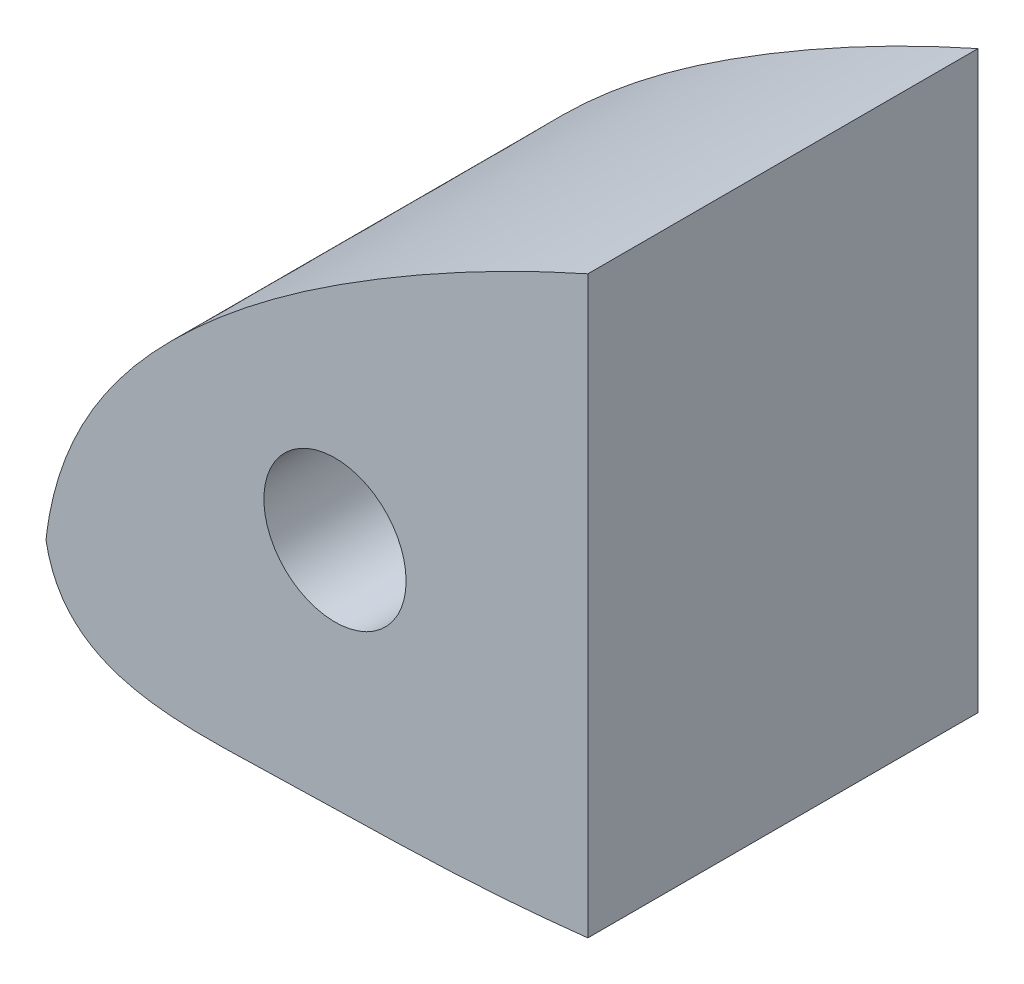
from build123d import *

# Parameters (mm, degrees)
BOSS_EXTRUDE1_DEPTH = 27.432
SKETCH2_R           = 5
SKETCH2_R_2         = 3.175
CUT_EXTRUDE1_DEPTH  = 317.917465392
SKETCH3_W           = 293.188888759
SKETCH3_H           = 137.971241769
CUT_EXTRUDE2_DEPTH  = 317.917465392


with BuildPart() as part:
    # Sketch1 → Boss-Extrude1 (new body)
    with BuildSketch(Plane.XY):
        with BuildLine():
            add(Edge.make_bspline(
                [(0.000560351, 0.000130087), (0.810633127, 7.359196055), (8.649092025, 17.856605174), (26.286719818, 29.975176328), (52.111128271, 42.069215275), (89.597618475, 49.290763054), (131.400792109, 47.884831915), (173.256699242, 40.041104278), (217.961060472, 29.612974894), (256.952064401, 19.528920948), (290.35983767, 8.71099439), (301.273197721, 4.382828139), (314.816918223, -0.516206742), (309.846313895, 0.000130087)],
                knots=[0, 0, 0, 0, 0.060863618, 0.113688265, 0.188608742, 0.312908923, 0.448482434, 0.557612135, 0.691544113, 0.852438279, 0.92975597, 0.976058229, 1, 1, 1, 1], degree=3))
            add(Edge.make_bspline(
                [(309.846313895, 0.000130087), (303.956832565, 1.47095521), (293.989507544, 2.093987313), (276.26402299, 4.514356704), (260.846344817, 5.427413394), (235.858814759, 7.870306192), (205.101424636, 8.838080282), (157.718638092, 9.030650149), (110.497331172, 6.181495223), (66.506197185, -0.586669107), (36.454672816, -6.098499901), (15.316603331, -6.189065841), (1.230714189, -6.924076091), (0.000560351, 0.000130087)],
                knots=[0, 0, 0, 0, 0.057787081, 0.095274891, 0.171021118, 0.205339302, 0.335319146, 0.464904334, 0.658702312, 0.785511947, 0.893517288, 0.94309214, 1, 1, 1, 1], degree=3))
        make_face()
    extrude(amount=BOSS_EXTRUDE1_DEPTH)

    # Sketch2 → Cut-Extrude1 (cut, through all)
    with BuildSketch(Plane.XY.offset(27.432)):
        with Locations((20.32, 10.16)):
            Circle(SKETCH2_R)
        with Locations((227.296313895, 19.050130087)):
            Circle(SKETCH2_R_2)
    extrude(amount=-CUT_EXTRUDE1_DEPTH, mode=Mode.SUBTRACT)

    # Sketch3 → Cut-Extrude2 (cut, through all)
    with BuildSketch(Plane.XY.offset(27.432)):
        with Locations((184.69444438, 2.732377951)):
            Rectangle(SKETCH3_W, SKETCH3_H)
    extrude(amount=-CUT_EXTRUDE2_DEPTH, mode=Mode.SUBTRACT)


solid = part.part
